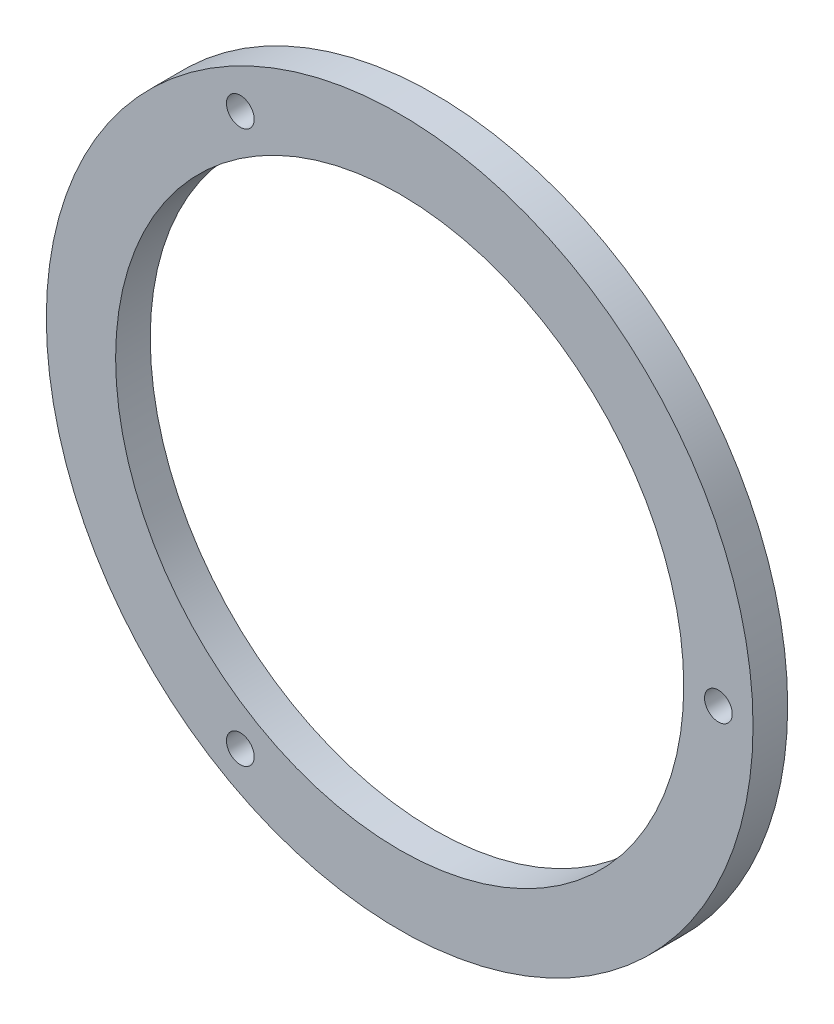
from build123d import *

# Parameters (mm, degrees)
ESQUISSE1_R        = 51
ESQUISSE1_R_2      = 2
ESQUISSE1_R_3      = 41
BOSS_EXTRU_1_DEPTH = 5


with BuildPart() as part:
    # Esquisse1 → Boss.-Extru.1 (new body)
    with BuildSketch(Plane.XY):
        Circle(ESQUISSE1_R)
        with Locations((46, 0)):
            Circle(ESQUISSE1_R_2, mode=Mode.SUBTRACT)
        with Locations((-23, -39.837168574)):
            Circle(ESQUISSE1_R_2, mode=Mode.SUBTRACT)
        with Locations((-23, 39.837168574)):
            Circle(ESQUISSE1_R_2, mode=Mode.SUBTRACT)
        Circle(ESQUISSE1_R_3, mode=Mode.SUBTRACT)
    extrude(amount=BOSS_EXTRU_1_DEPTH)


solid = part.part
